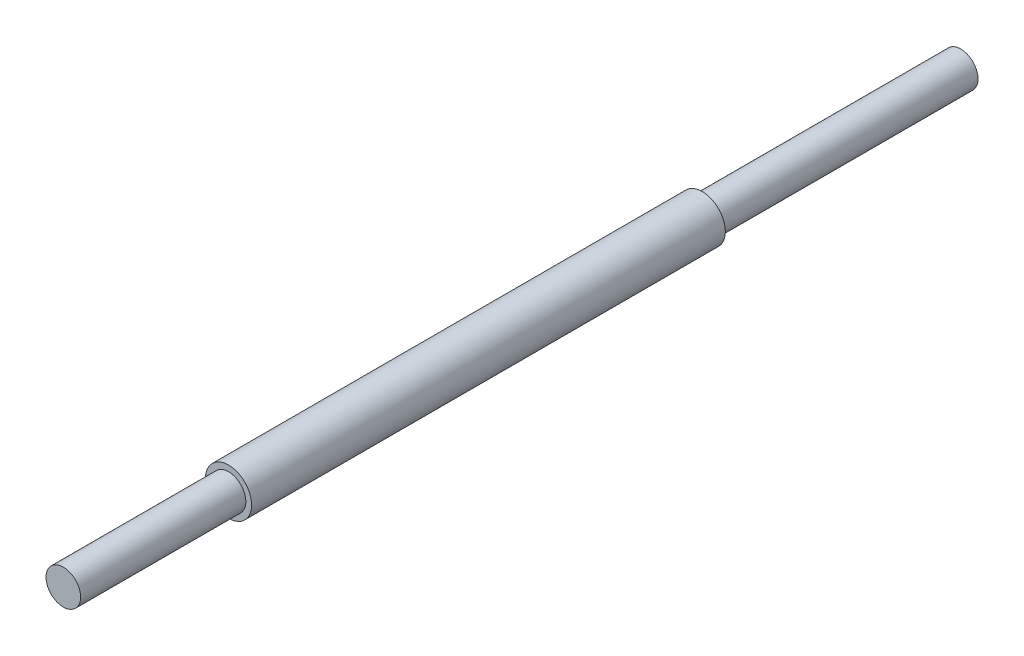
from build123d import *

# Parameters (mm, degrees)
SKETCH1_R           = 6.35
BOSS_EXTRUDE1_DEPTH = 130.3528
SKETCH2_R           = 4.7625
BOSS_EXTRUDE2_DEPTH = 45.466
BOSS_EXTRUDE3_START = 71.12
SKETCH3_R           = 4.7625
BOSS_EXTRUDE3_DEPTH = 71.12


with BuildPart() as part:
    # Sketch1 → Boss-Extrude1 (new body)
    with BuildSketch(Plane.XY):
        Circle(SKETCH1_R)
    extrude(amount=BOSS_EXTRUDE1_DEPTH)

    # Sketch2 → Boss-Extrude2 (add)
    with BuildSketch(Plane.XY.offset(130.3528)):
        with Locations(Location((0, 0, 0), (0, 0, 180))):
            Circle(SKETCH2_R)
    extrude(amount=BOSS_EXTRUDE2_DEPTH)

    # Sketch3 → Boss-Extrude3 (add)
    with BuildSketch(Plane(origin=(0, 0, 0), x_dir=(-1, 0, 0), z_dir=(0, 0, -1)).offset(BOSS_EXTRUDE3_START)):
        Circle(SKETCH3_R)
    extrude(amount=-BOSS_EXTRUDE3_DEPTH)


solid = part.part
